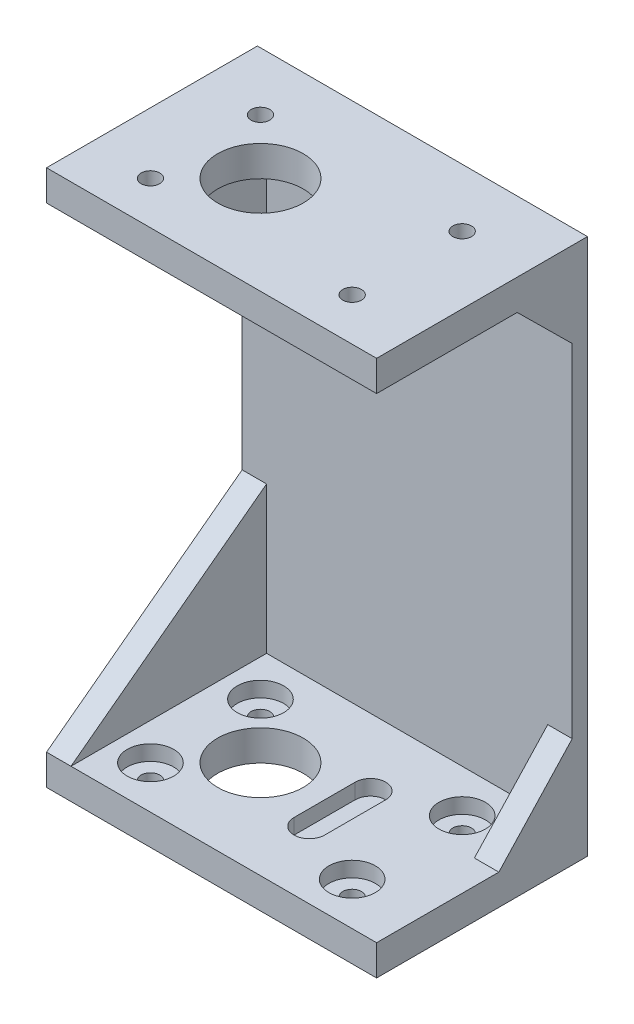
from build123d import *

# Parameters (mm, degrees)
SKETCH2_W           = 46
SKETCH2_H           = 32
SKETCH2_R           = 1.525
SKETCH2_R_2         = 7
BOSS_EXTRUDE1_DEPTH = 5
SKETCH3_R           = 3.8
CUT_EXTRUDE1_DEPTH  = 2.5
BOSS_EXTRUDE2_DEPTH = 87.8
BOSS_EXTRUDE3_START = 82.8
SKETCH2_2_W         = 46
SKETCH2_2_H         = 32
SKETCH2_2_R         = 1.525
SKETCH2_2_R_2       = 7
BOSS_EXTRUDE3_DEPTH = 5
CUT_EXTRUDE2_START  = 80.3
SKETCH3_3_R         = 3.8
CUT_EXTRUDE2_DEPTH  = 2.5
CUT_EXTRUDE3_DEPTH  = 5
CUT_EXTRUDE4_DEPTH  = 5


with BuildPart() as part:
    # Sketch2 → Boss-Extrude1 (new body)
    with BuildSketch(Plane(origin=(0, 0, 0), x_dir=(1, 0, 0), z_dir=(0, 1, 0))):
        Rectangle(SKETCH2_W, SKETCH2_H)
        with Locations(Location((-17, 9, 0), (0, 0, 270))):
            Circle(SKETCH2_R, mode=Mode.SUBTRACT)
        with Locations(Location((-17, -9, 0), (0, 0, 270))):
            Circle(SKETCH2_R, mode=Mode.SUBTRACT)
        with Locations(Location((16, -9, 0), (0, 0, 270))):
            Circle(SKETCH2_R, mode=Mode.SUBTRACT)
        with Locations(Location((16, 9, 0), (0, 0, 270))):
            Circle(SKETCH2_R, mode=Mode.SUBTRACT)
        with Locations(Location((-8, 0, 0), (0, 0, 270))):
            Circle(SKETCH2_R_2, mode=Mode.SUBTRACT)
    extrude(amount=BOSS_EXTRUDE1_DEPTH)

    # Sketch3 → Cut-Extrude1 (cut)
    with BuildSketch(Plane(origin=(0, 5, 0), x_dir=(1, 0, 0), z_dir=(0, 1, 0))):
        with Locations(Location((-17, 9, 0), (0, 0, 270))):
            Circle(SKETCH3_R)
        with Locations(Location((-17, -9, 0), (0, 0, 270))):
            Circle(SKETCH3_R)
        with Locations(Location((16, -9, 0), (0, 0, 270))):
            Circle(SKETCH3_R)
        with Locations(Location((16, 9, 0), (0, 0, 270))):
            Circle(SKETCH3_R)
        with BuildLine():
            Line((7.5, 5), (7.5, -5))
            ThreePointArc((7.5, -5), (5, -7.5), (2.5, -5))
            Line((2.5, -5), (2.5, 5))
            ThreePointArc((2.5, 5), (5, 7.5), (7.5, 5))
        make_face()
    extrude(amount=-CUT_EXTRUDE1_DEPTH, mode=Mode.SUBTRACT)

    # Sketch4 → Boss-Extrude2 (add)
    with BuildSketch(Plane(origin=(0, 0, 0), x_dir=(-1, 0, 0), z_dir=(0, -1, 0))):
        Polygon((23, 16), (-23, 16), (-23, -16), (-27, -16), (-27, 18.5), (27, 18.5), (27, -16), (23, -16), align=None)
    extrude(amount=-BOSS_EXTRUDE2_DEPTH)

    # Sketch2<2> → Boss-Extrude3 (add)
    with BuildSketch(Plane(origin=(0, 0, 0), x_dir=(1, 0, 0), z_dir=(0, 1, 0)).offset(BOSS_EXTRUDE3_START)):
        Rectangle(SKETCH2_2_W, SKETCH2_2_H)
        with Locations(Location((-17, 9, 0), (0, 0, 270))):
            Circle(SKETCH2_2_R, mode=Mode.SUBTRACT)
        with Locations(Location((-17, -9, 0), (0, 0, 270))):
            Circle(SKETCH2_2_R, mode=Mode.SUBTRACT)
        with Locations(Location((16, -9, 0), (0, 0, 270))):
            Circle(SKETCH2_2_R, mode=Mode.SUBTRACT)
        with Locations(Location((16, 9, 0), (0, 0, 270))):
            Circle(SKETCH2_2_R, mode=Mode.SUBTRACT)
        with Locations(Location((-8, 0, 0), (0, 0, 270))):
            Circle(SKETCH2_2_R_2, mode=Mode.SUBTRACT)
    extrude(amount=BOSS_EXTRUDE3_DEPTH)

    # Sketch3<3> → Cut-Extrude2 (cut)
    with BuildSketch(Plane(origin=(0, 5, 0), x_dir=(1, 0, 0), z_dir=(0, 1, 0)).offset(CUT_EXTRUDE2_START)):
        with Locations(Location((-17, 9, 0), (0, 0, 270))):
            Circle(SKETCH3_3_R)
        with Locations(Location((-17, -9, 0), (0, 0, 270))):
            Circle(SKETCH3_3_R)
        with Locations(Location((16, -9, 0), (0, 0, 270))):
            Circle(SKETCH3_3_R)
        with Locations(Location((16, 9, 0), (0, 0, 270))):
            Circle(SKETCH3_3_R)
        with BuildLine():
            Line((7.5, 5), (7.5, -5))
            ThreePointArc((7.5, -5), (5, -7.5), (2.5, -5))
            Line((2.5, -5), (2.5, 5))
            ThreePointArc((2.5, 5), (5, 7.5), (7.5, 5))
        make_face()
    extrude(amount=-CUT_EXTRUDE2_DEPTH, mode=Mode.SUBTRACT)

    # Sketch5 → Cut-Extrude3 (cut)
    with BuildSketch(Plane(origin=(27, 0, 0), x_dir=(0, 0, -1), z_dir=(1, 0, 0))):
        Polygon((-16, 43.9), (-16, 5), (4, 5), (16, 17.9), (16, 43.9), align=None)
        Polygon((-16, 82.8), (-16, 43.9), (16, 43.9), (16, 73.9), (7, 82.8), align=None)
    extrude(amount=-CUT_EXTRUDE3_DEPTH, mode=Mode.SUBTRACT)

    # Sketch6 → Cut-Extrude4 (cut)
    with BuildSketch(Plane.ZY.offset(27)):
        Polygon((16, 82.8), (16, 5), (-16, 29), (-16, 58.8), align=None)
    extrude(amount=-CUT_EXTRUDE4_DEPTH, mode=Mode.SUBTRACT)


solid = part.part
